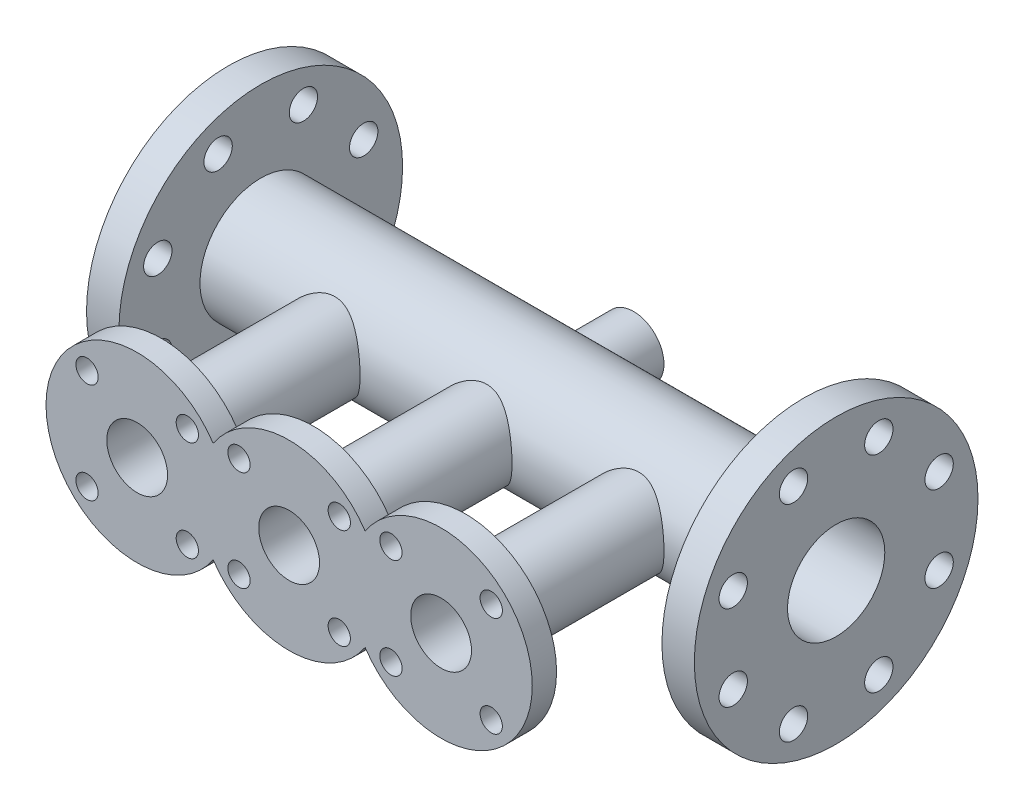
from build123d import *

# Parameters (mm, degrees)
SKETCH_1_R           = 30
EXTRUDE_1_DEPTH      = 300
SKETCH_2_R           = 70
EXTRUDE_2_DEPTH      = 16
SKETCH_3_R           = 70
EXTRUDE_3_DEPTH      = 16
SKETCH_4_R           = 20
EXTRUDE_4_DEPTH      = 120
SKETCH_5_R           = 20
EXTRUDE_5_DEPTH      = 120
SKETCH_6_R           = 20
EXTRUDE_6_DEPTH      = 120
SKETCH_7_R           = 15
EXTRUDE_7_DEPTH      = 50
SKETCH_8_R           = 45
EXTRUDE_8_DEPTH      = 12
SKETCH_9_R           = 45
EXTRUDE_9_DEPTH      = 12
SKETCH_10_R          = 45
EXTRUDE_10_DEPTH     = 12
SKETCH_11_R          = 24
CUT_EXTRUDE_1_DEPTH  = 331.605505096
SKETCH_12_R          = 15
CUT_EXTRUDE_2_DEPTH  = 120
CUT_EXTRUDE_START    = -120
SKETCH_13_R          = 15
CUT_EXTRUDE_3_DEPTH  = 120
SKETCH_14_R          = 15
CUT_EXTRUDE_4_DEPTH  = 120
SKETCH_15_R          = 6
CUT_EXTRUDE_5_DEPTH  = 50
SKETCH_18_R          = 5.5
CUT_EXTRUDE_9_DEPTH  = 12
SKETCH_19_R          = 5.5
CUT_EXTRUDE_10_DEPTH = 12
SKETCH_20_R          = 5.5
CUT_EXTRUDE_11_DEPTH = 12
SKETCH_21_R          = 7
CUT_EXTRUDE_12_DEPTH = 16
SKETCH_22_R          = 7
CUT_EXTRUDE_13_DEPTH = 16


with BuildPart() as part:
    # 草图1 → 凸台-拉伸1 (new body)
    with BuildSketch(Plane(origin=(0, 0, 0), x_dir=(0, 0, -1), z_dir=(1, 0, 0))):
        Circle(SKETCH_1_R)
    extrude(amount=EXTRUDE_1_DEPTH)

    # 草图2 → 凸台-拉伸2 (add)
    with BuildSketch(Plane(origin=(0, 0, 0), x_dir=(0, 0, -1), z_dir=(1, 0, 0))):
        Circle(SKETCH_2_R)
    extrude(amount=EXTRUDE_2_DEPTH)

    # 草图3 → 凸台-拉伸3 (add)
    with BuildSketch(Plane(origin=(284, 0, 0), x_dir=(0, 0, -1), z_dir=(1, 0, 0))):
        Circle(SKETCH_3_R)
    extrude(amount=EXTRUDE_3_DEPTH)

    # 草图4 → 凸台-拉伸4 (add)
    with BuildSketch(Plane.XY):
        with Locations((75, 0)):
            Circle(SKETCH_4_R)
    extrude(amount=EXTRUDE_4_DEPTH)

    # 草图5 → 凸台-拉伸5 (add)
    with BuildSketch(Plane.XY):
        with Locations((150, 0)):
            Circle(SKETCH_5_R)
    extrude(amount=EXTRUDE_5_DEPTH)

    # 草图6 → 凸台-拉伸6 (add)
    with BuildSketch(Plane.XY):
        with Locations((225, 0)):
            Circle(SKETCH_6_R)
    extrude(amount=EXTRUDE_6_DEPTH)

    # 草图7 → 凸台-拉伸7 (add)
    with BuildSketch(Plane.XY.offset(-50)):
        with Locations((150, 0)):
            Circle(SKETCH_7_R)
    extrude(amount=EXTRUDE_7_DEPTH)

    # 草图8 → 凸台-拉伸8 (add)
    with BuildSketch(Plane.XY.offset(108)):
        with Locations((75, 0)):
            Circle(SKETCH_8_R)
    extrude(amount=EXTRUDE_8_DEPTH)

    # 草图9 → 凸台-拉伸9 (add)
    with BuildSketch(Plane.XY.offset(108)):
        with Locations((150, 0)):
            Circle(SKETCH_9_R)
    extrude(amount=EXTRUDE_9_DEPTH)

    # 草图10 → 凸台-拉伸10 (add)
    with BuildSketch(Plane.XY.offset(108)):
        with Locations((225, 0)):
            Circle(SKETCH_10_R)
    extrude(amount=EXTRUDE_10_DEPTH)

    # 草图11 → 切除-拉伸1 (cut, through all)
    with BuildSketch(Plane(origin=(0, 0, 0), x_dir=(0, 0, -1), z_dir=(1, 0, 0))):
        Circle(SKETCH_11_R)
    extrude(amount=CUT_EXTRUDE_1_DEPTH, mode=Mode.SUBTRACT)

    # 草图12 → 切除-拉伸2 (cut)
    with BuildSketch(Plane.XY.offset(120)):
        with Locations((75, 0)):
            Circle(SKETCH_12_R)
    extrude(amount=-CUT_EXTRUDE_2_DEPTH, mode=Mode.SUBTRACT)

    # 草图13 → 切除-拉伸3 (cut)
    with BuildSketch(Plane.XY.offset(120).offset(CUT_EXTRUDE_START)):
        with Locations((150, 0)):
            Circle(SKETCH_13_R)
    extrude(amount=CUT_EXTRUDE_3_DEPTH, mode=Mode.SUBTRACT)

    # 草图14 → 切除-拉伸4 (cut)
    with BuildSketch(Plane.XY.offset(120)):
        with Locations((225, 0)):
            Circle(SKETCH_14_R)
    extrude(amount=-CUT_EXTRUDE_4_DEPTH, mode=Mode.SUBTRACT)

    # 草图15 → 切除-拉伸5 (cut)
    with BuildSketch(Plane.XY.offset(-50)):
        with Locations((150, 0)):
            Circle(SKETCH_15_R)
    extrude(amount=CUT_EXTRUDE_5_DEPTH, mode=Mode.SUBTRACT)

    # 草图18 → 切除-拉伸9 (cut)
    with BuildSketch(Plane.XY.offset(120)):
        with Locations((99.748737, 24.748737)):
            Circle(SKETCH_18_R)
        with Locations((50.251263, 24.748737)):
            Circle(SKETCH_18_R)
        with Locations((50.251263, -24.748737)):
            Circle(SKETCH_18_R)
        with Locations((99.748737, -24.748737)):
            Circle(SKETCH_18_R)
    extrude(amount=-CUT_EXTRUDE_9_DEPTH, mode=Mode.SUBTRACT)

    # 草图19 → 切除-拉伸10 (cut)
    with BuildSketch(Plane.XY.offset(120)):
        with Locations((174.748737, 24.748737)):
            Circle(SKETCH_19_R)
        with Locations((125.251263, 24.748737)):
            Circle(SKETCH_19_R)
        with Locations((125.251263, -24.748737)):
            Circle(SKETCH_19_R)
        with Locations((174.748737, -24.748737)):
            Circle(SKETCH_19_R)
    extrude(amount=-CUT_EXTRUDE_10_DEPTH, mode=Mode.SUBTRACT)

    # 草图20 → 切除-拉伸11 (cut)
    with BuildSketch(Plane.XY.offset(120)):
        with Locations((249.748737, 24.748737)):
            Circle(SKETCH_20_R)
        with Locations((200.251263, 24.748737)):
            Circle(SKETCH_20_R)
        with Locations((200.251263, -24.748737)):
            Circle(SKETCH_20_R)
        with Locations((249.748737, -24.748737)):
            Circle(SKETCH_20_R)
    extrude(amount=-CUT_EXTRUDE_11_DEPTH, mode=Mode.SUBTRACT)

    # 草图21 → 切除-拉伸12 (cut)
    with BuildSketch(Plane(origin=(0, 0, 0), x_dir=(0, 0, -1), z_dir=(1, 0, 0))):
        with Locations((-50.813374, 21.047589)):
            Circle(SKETCH_21_R)
        with Locations((-21.047589, 50.813374)):
            Circle(SKETCH_21_R)
        with Locations((21.047589, 50.813374)):
            Circle(SKETCH_21_R)
        with Locations((50.813374, 21.047589)):
            Circle(SKETCH_21_R)
        with Locations((50.813374, -21.047589)):
            Circle(SKETCH_21_R)
        with Locations((21.047589, -50.813374)):
            Circle(SKETCH_21_R)
        with Locations((-21.047589, -50.813374)):
            Circle(SKETCH_21_R)
        with Locations((-50.813374, -21.047589)):
            Circle(SKETCH_21_R)
    extrude(amount=CUT_EXTRUDE_12_DEPTH, mode=Mode.SUBTRACT)

    # 草图22 → 切除-拉伸13 (cut)
    with BuildSketch(Plane(origin=(284, 0, 0), x_dir=(0, 0, -1), z_dir=(1, 0, 0))):
        with Locations((-50.813374, 21.047589)):
            Circle(SKETCH_22_R)
        with Locations((-21.047589, 50.813374)):
            Circle(SKETCH_22_R)
        with Locations((21.047589, 50.813374)):
            Circle(SKETCH_22_R)
        with Locations((50.813374, 21.047589)):
            Circle(SKETCH_22_R)
        with Locations((50.813374, -21.047589)):
            Circle(SKETCH_22_R)
        with Locations((21.047589, -50.813374)):
            Circle(SKETCH_22_R)
        with Locations((-21.047589, -50.813374)):
            Circle(SKETCH_22_R)
        with Locations((-50.813374, -21.047589)):
            Circle(SKETCH_22_R)
    extrude(amount=CUT_EXTRUDE_13_DEPTH, mode=Mode.SUBTRACT)


solid = part.part
